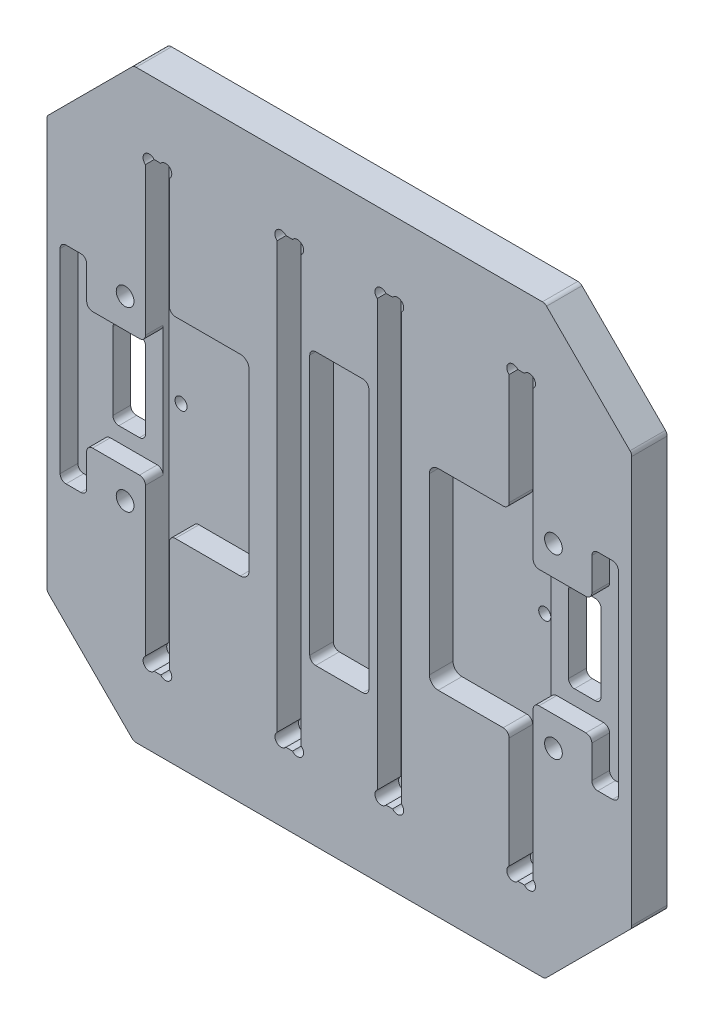
from build123d import *

# Parameters (mm, degrees)
ESQUISSE2_W                   = 200
ESQUISSE2_H                   = 200
BOSS_EXTRU_1_DEPTH            = 12
ENL_V_MAT_EXTRU_1_DEPTH       = 284.097156468
ENL_V_MAT_EXTRU_1_DEPTH_BACK  = 284.097156468
ESQUISSE3_R                   = 3
CHANFREIN1_SIZE               = 30
ENL_V_MAT_EXTRU_2_DEPTH       = 10
ESQUISSE5_W                   = 20
ESQUISSE5_H                   = 40
ENL_V_MAT_EXTRU_3_DEPTH       = 6
ESQUISSE6_W                   = 8.12
ESQUISSE6_H                   = 150
ENL_V_MAT_EXTRU_4_DEPTH       = 8
ESQUISSE7_R                   = 2.1
ENL_V_MAT_EXTRU_5_DEPTH       = 8
ESQUISSE8_W                   = 20
ESQUISSE8_H                   = 92
ENL_V_MAT_EXTRU_6_DEPTH       = 8
ENL_V_START                   = -8
ENL_V_MAT_EXTRU_8_DEPTH       = 8
ENL_V_MAT_EXTRU_9_DEPTH       = 283.906344927
ENL_V_MAT_EXTRU_9_DEPTH_BACK  = 283.906344927
ESQUISSE11_W                  = 11
ESQUISSE11_H                  = 30
CONG_1_R                      = 2
CONG_2_R                      = 2
ENL_V_MAT_EXTRU_7_DEPTH       = 284.097156468
ENL_V_MAT_EXTRU_7_DEPTH_BACK  = 284.097156468
CONG_3_R                      = 2
BOSS_EXTRU_2_START            = -4
BOSS_EXTRU_2_DEPTH            = 4
BOSS_EXTRU_3_DEPTH            = 6
ENL_V_MAT_EXTRU_10_DEPTH      = 282.542181564
ENL_V_MAT_EXTRU_10_DEPTH_BACK = 282.542181564
ESQUISSE14_R                  = 2.05


with BuildPart() as part:
    # Esquisse2 → Boss.-Extru.1 (new body)
    with BuildSketch(Plane.XY):
        with Locations((100, 100)):
            Rectangle(ESQUISSE2_W, ESQUISSE2_H)
    extrude(amount=BOSS_EXTRU_1_DEPTH)

    # Esquisse3 → Enlèv. mat.-Extru.1 (cut, two sides: drawn at the far end of the back side and taken through both)
    with BuildSketch(Plane.XY.offset(12).offset(-ENL_V_MAT_EXTRU_1_DEPTH_BACK)):
        with Locations((172.5, 130)):
            Circle(ESQUISSE3_R)
        with Locations(Location((172.5, 70, 0), (0, 0, 180))):
            Circle(ESQUISSE3_R)
        with Locations((27.5, 70)):
            Circle(ESQUISSE3_R)
        with Locations(Location((27.5, 130, 0), (0, 0, 180))):
            Circle(ESQUISSE3_R)
        with BuildLine():
            Line((185.5, 67), (185.5, 133))
            ThreePointArc((185.5, 133), (186.085786438, 134.414213562), (187.5, 135))
            Line((187.5, 135), (192.5, 135))
            ThreePointArc((192.5, 135), (193.914213562, 134.414213562), (194.5, 133))
            Line((194.5, 133), (194.5, 67))
            ThreePointArc((194.5, 67), (193.914213562, 65.585786438), (192.5, 65))
            Line((192.5, 65), (187.5, 65))
            ThreePointArc((187.5, 65), (186.085786438, 65.585786438), (185.5, 67))
        make_face()
        with BuildLine():
            Line((12.5, 65), (7.5, 65))
            ThreePointArc((7.5, 65), (6.085786438, 65.585786438), (5.5, 67))
            Line((5.5, 67), (5.5, 133))
            ThreePointArc((5.5, 133), (6.085786438, 134.414213562), (7.5, 135))
            Line((7.5, 135), (12.5, 135))
            ThreePointArc((12.5, 135), (13.914213562, 134.414213562), (14.5, 133))
            Line((14.5, 133), (14.5, 67))
            ThreePointArc((14.5, 67), (13.914213562, 65.585786438), (12.5, 65))
        make_face()
        with BuildLine():
            Line((69.5, 70.5), (69.5, 129.5))
            ThreePointArc((69.5, 129.5), (68.621320344, 131.621320344), (66.5, 132.5))
            Line((66.5, 132.5), (45.5, 132.5))
            ThreePointArc((45.5, 132.5), (43.378679656, 131.621320344), (42.5, 129.5))
            Line((42.5, 129.5), (42.5, 70.5))
            ThreePointArc((42.5, 70.5), (43.378679656, 68.378679656), (45.5, 67.5))
            Line((45.5, 67.5), (66.5, 67.5))
            ThreePointArc((66.5, 67.5), (68.621320344, 68.378679656), (69.5, 70.5))
        make_face()
        with BuildLine():
            Line((133.5, 67.5), (154.5, 67.5))
            ThreePointArc((154.5, 67.5), (156.621320344, 68.378679656), (157.5, 70.5))
            Line((157.5, 70.5), (157.5, 129.5))
            ThreePointArc((157.5, 129.5), (156.621320344, 131.621320344), (154.5, 132.5))
            Line((154.5, 132.5), (133.5, 132.5))
            ThreePointArc((133.5, 132.5), (131.378679656, 131.621320344), (130.5, 129.5))
            Line((130.5, 129.5), (130.5, 70.5))
            ThreePointArc((130.5, 70.5), (131.378679656, 68.378679656), (133.5, 67.5))
        make_face()
    extrude(amount=ENL_V_MAT_EXTRU_1_DEPTH + ENL_V_MAT_EXTRU_1_DEPTH_BACK, mode=Mode.SUBTRACT)

    # Chanfrein1
    chanfrein1_edges = [part.edges().sort_by_distance(p)[0] for p in [
        (0, 200, 6),
        (200, 200, 6),
        (200, 0, 6),
        (0, 0, 6),
    ]]
    chamfer(chanfrein1_edges, length=CHANFREIN1_SIZE)

    # Esquisse4 → Enlèv. mat.-Extru.2 (cut)
    with BuildSketch(Plane.XY.offset(12)):
        Polygon((170, 200), (30, 200), (0, 170), (0, 30), (30, 0), (170, 0), (200, 30), (200, 170), align=None)
        Polygon((169.585786438, 199), (30.414213562, 199), (1, 169.585786438), (1, 30.414213562), (30.414213562, 1), (169.585786438, 1), (199, 30.414213562), (199, 169.585786438), align=None, mode=Mode.SUBTRACT)
    extrude(amount=-ENL_V_MAT_EXTRU_2_DEPTH, mode=Mode.SUBTRACT)

    # Esquisse5 → Enlèv. mat.-Extru.3 (cut)
    with BuildSketch(Plane.XY.offset(12)):
        with Locations((24.5, 100)):
            Rectangle(ESQUISSE5_W, ESQUISSE5_H)
        with Locations((175.5, 100)):
            Rectangle(ESQUISSE5_W, ESQUISSE5_H)
    extrude(amount=-ENL_V_MAT_EXTRU_3_DEPTH, mode=Mode.SUBTRACT)

    # Esquisse6 → Enlèv. mat.-Extru.4 (cut)
    with BuildSketch(Plane.XY.offset(12)):
        with Locations((161.56, 100)):
            Rectangle(ESQUISSE6_W, ESQUISSE6_H)
        with Locations((38.44, 100)):
            Rectangle(ESQUISSE6_W, ESQUISSE6_H)
        with Locations((116.94, 100)):
            Rectangle(ESQUISSE6_W, ESQUISSE6_H)
        with Locations((83.06, 100)):
            Rectangle(ESQUISSE6_W, ESQUISSE6_H)
    extrude(amount=-ENL_V_MAT_EXTRU_4_DEPTH, mode=Mode.SUBTRACT)

    # Esquisse7 → Enlèv. mat.-Extru.5 (cut)
    with BuildSketch(Plane.XY.offset(12)):
        with Locations((114.18, 173.7)):
            Circle(ESQUISSE7_R)
        with Locations((119.7, 173.7)):
            Circle(ESQUISSE7_R)
        with Locations((119.7, 26.3)):
            Circle(ESQUISSE7_R)
        with Locations((114.18, 26.3)):
            Circle(ESQUISSE7_R)
        with Locations((164.32, 26.3)):
            Circle(ESQUISSE7_R)
        with Locations((158.8, 26.3)):
            Circle(ESQUISSE7_R)
        with Locations((158.8, 173.7)):
            Circle(ESQUISSE7_R)
        with Locations((164.32, 173.7)):
            Circle(ESQUISSE7_R)
        with Locations((35.68, 173.7)):
            Circle(ESQUISSE7_R)
        with Locations((41.2, 173.7)):
            Circle(ESQUISSE7_R)
        with Locations((41.2, 26.3)):
            Circle(ESQUISSE7_R)
        with Locations((35.68, 26.3)):
            Circle(ESQUISSE7_R)
        with Locations((85.82, 26.3)):
            Circle(ESQUISSE7_R)
        with Locations((80.3, 26.3)):
            Circle(ESQUISSE7_R)
        with Locations((80.3, 173.7)):
            Circle(ESQUISSE7_R)
        with Locations((85.82, 173.7)):
            Circle(ESQUISSE7_R)
    extrude(amount=-ENL_V_MAT_EXTRU_5_DEPTH, mode=Mode.SUBTRACT)

    # Esquisse8 → Enlèv. mat.-Extru.6 (cut)
    with BuildSketch(Plane.XY.offset(12)):
        with Locations((100, 100)):
            Rectangle(ESQUISSE8_W, ESQUISSE8_H)
    extrude(amount=-ENL_V_MAT_EXTRU_6_DEPTH, mode=Mode.SUBTRACT)

    # Esquisse10 → Enlèv. mat.-Extru.8 (cut)
    with BuildSketch(Plane.XY.offset(12).offset(ENL_V_START)):
        Polygon((45.5, 132.5), (42.5, 132.5), (42.5, 129.5), align=None)
        Polygon((42.5, 70.5), (45.5, 67.5), (42.5, 67.5), align=None)
        Polygon((154.5, 67.5), (157.5, 67.5), (157.5, 70.5), align=None)
        Polygon((157.5, 129.5), (154.5, 132.5), (157.5, 132.5), align=None)
    extrude(amount=ENL_V_MAT_EXTRU_8_DEPTH, mode=Mode.SUBTRACT)

    # Esquisse11 → Enlèv. mat.-Extru.9 (cut, two sides: drawn at the far end of the back side and taken through both)
    with BuildSketch(Plane.XY.offset(6).offset(-ENL_V_MAT_EXTRU_9_DEPTH_BACK)):
        with Locations((22.88, 100)):
            Rectangle(ESQUISSE11_W, ESQUISSE11_H)
        with Locations((177.12, 100)):
            Rectangle(ESQUISSE11_W, ESQUISSE11_H)
    extrude(amount=ENL_V_MAT_EXTRU_9_DEPTH + ENL_V_MAT_EXTRU_9_DEPTH_BACK, mode=Mode.SUBTRACT)

    # Congé1
    cong_1_edges = [part.edges().sort_by_distance(p)[0] for p in [
        (185.5, 120, 9),
        (185.5, 80, 9),
        (14.5, 120, 9),
        (14.5, 80, 9),
        (165.62, 120, 9),
        (165.62, 80, 9),
        (34.38, 120, 9),
        (34.38, 80, 9),
        (90, 146, 8),
        (110, 146, 8),
        (110, 54, 8),
        (90, 54, 8),
        (42.5, 132.5, 8),
        (42.5, 67.5, 8),
        (157.5, 67.5, 8),
        (157.5, 132.5, 8),
    ]]
    fillet(cong_1_edges, radius=CONG_1_R)

    # Congé2
    cong_2_edges = [part.edges().sort_by_distance(p)[0] for p in [
        (0, 30, 1),
        (30, 200, 1),
        (200, 170, 1),
        (170, 0, 1),
        (30, 0, 1),
        (200, 30, 1),
        (170, 200, 1),
        (0, 170, 1),
        (199, 169.585786438, 7),
        (199, 30.414213562, 7),
        (169.585786438, 1, 7),
        (30.414213562, 1, 7),
        (1, 30.414213562, 7),
        (1, 169.585786438, 7),
        (30.414213562, 199, 7),
        (169.585786438, 199, 7),
    ]]
    fillet(cong_2_edges, radius=CONG_2_R)

    # Esquisse9 → Enlèv. mat.-Extru.7 (cut, two sides: drawn at the far end of the back side and taken through both)
    with BuildSketch(Plane.XY.offset(12).offset(-ENL_V_MAT_EXTRU_7_DEPTH_BACK)):
        with BuildLine():
            Line((22.757359313, 205.485281374), (-5.485281374, 177.242640687))
            ThreePointArc((-5.485281374, 177.242640687), (-8.08655439, 173.349560501), (-9, 168.757359313))
            Line((-9, 168.757359313), (-9, 31.242640687))
            ThreePointArc((-9, 31.242640687), (-8.08655439, 26.650439499), (-5.485281374, 22.757359313))
            Line((-5.485281374, 22.757359313), (22.757359313, -5.485281374))
            ThreePointArc((22.757359313, -5.485281374), (26.650439499, -8.08655439), (31.242640687, -9))
            Line((31.242640687, -9), (168.757359313, -9))
            ThreePointArc((168.757359313, -9), (173.349560501, -8.08655439), (177.242640687, -5.485281374))
            Line((177.242640687, -5.485281374), (205.485281374, 22.757359313))
            ThreePointArc((205.485281374, 22.757359313), (208.08655439, 26.650439499), (209, 31.242640687))
            Line((209, 31.242640687), (209, 168.757359313))
            ThreePointArc((209, 168.757359313), (208.08655439, 173.349560501), (205.485281374, 177.242640687))
            Line((205.485281374, 177.242640687), (177.242640687, 205.485281374))
            ThreePointArc((177.242640687, 205.485281374), (173.349560501, 208.08655439), (168.757359313, 209))
            Line((168.757359313, 209), (31.242640687, 209))
            ThreePointArc((31.242640687, 209), (26.650439499, 208.08655439), (22.757359313, 205.485281374))
        make_face()
        with BuildLine():
            Line((29.828427125, 198.414213562), (1.585786438, 170.171572875))
            ThreePointArc((1.585786438, 170.171572875), (1.152240935, 169.522726178), (1, 168.757359313))
            Line((1, 168.757359313), (1, 31.242640687))
            ThreePointArc((1, 31.242640687), (1.152240935, 30.477273822), (1.585786438, 29.828427125))
            Line((1.585786438, 29.828427125), (29.828427125, 1.585786438))
            ThreePointArc((29.828427125, 1.585786438), (30.477273822, 1.152240935), (31.242640687, 1))
            Line((31.242640687, 1), (168.757359313, 1))
            ThreePointArc((168.757359313, 1), (169.522726178, 1.152240935), (170.171572875, 1.585786438))
            Line((170.171572875, 1.585786438), (198.414213562, 29.828427125))
            ThreePointArc((198.414213562, 29.828427125), (198.847759065, 30.477273822), (199, 31.242640687))
            Line((199, 31.242640687), (199, 168.757359313))
            ThreePointArc((199, 168.757359313), (198.847759065, 169.522726178), (198.414213562, 170.171572875))
            Line((198.414213562, 170.171572875), (170.171572875, 198.414213562))
            ThreePointArc((170.171572875, 198.414213562), (169.522726178, 198.847759065), (168.757359313, 199))
            Line((168.757359313, 199), (31.242640687, 199))
            ThreePointArc((31.242640687, 199), (30.477273822, 198.847759065), (29.828427125, 198.414213562))
        make_face(mode=Mode.SUBTRACT)
    extrude(amount=ENL_V_MAT_EXTRU_7_DEPTH + ENL_V_MAT_EXTRU_7_DEPTH_BACK, mode=Mode.SUBTRACT)

    # Congé3
    cong_3_edges = [part.edges().sort_by_distance(p)[0] for p in [
        (17.38, 85, 3),
        (17.38, 115, 3),
        (28.38, 115, 3),
        (28.38, 85, 3),
        (171.62, 115, 3),
        (182.62, 115, 3),
        (182.62, 85, 3),
        (171.62, 85, 3),
    ]]
    fillet(cong_3_edges, radius=CONG_3_R)

    # Esquisse12 → Boss.-Extru.2 (add)
    with BuildSketch(Plane(origin=(0, 0, 0), x_dir=(-1, 0, 0), z_dir=(0, 0, -1)).offset(BOSS_EXTRU_2_START)):
        with BuildLine():
            Line((-69.5, 70.5), (-69.5, 129.5))
            ThreePointArc((-69.5, 129.5), (-68.621320344, 131.621320344), (-66.5, 132.5))
            Line((-66.5, 132.5), (-45.5, 132.5))
            ThreePointArc((-45.5, 132.5), (-43.378679656, 131.621320344), (-42.5, 129.5))
            Line((-42.5, 129.5), (-42.5, 70.5))
            ThreePointArc((-42.5, 70.5), (-43.378679656, 68.378679656), (-45.5, 67.5))
            Line((-45.5, 67.5), (-66.5, 67.5))
            ThreePointArc((-66.5, 67.5), (-68.621320344, 68.378679656), (-69.5, 70.5))
        make_face()
        with BuildLine():
            Line((-133.5, 67.5), (-154.5, 67.5))
            ThreePointArc((-154.5, 67.5), (-156.621320344, 68.378679656), (-157.5, 70.5))
            Line((-157.5, 70.5), (-157.5, 129.5))
            ThreePointArc((-157.5, 129.5), (-156.621320344, 131.621320344), (-154.5, 132.5))
            Line((-154.5, 132.5), (-133.5, 132.5))
            ThreePointArc((-133.5, 132.5), (-131.378679656, 131.621320344), (-130.5, 129.5))
            Line((-130.5, 129.5), (-130.5, 70.5))
            ThreePointArc((-130.5, 70.5), (-131.378679656, 68.378679656), (-133.5, 67.5))
        make_face()
    extrude(amount=BOSS_EXTRU_2_DEPTH)

    # Esquisse13 → Boss.-Extru.3 (add)
    with BuildSketch(Plane(origin=(0, 0, 0), x_dir=(-1, 0, 0), z_dir=(0, 0, -1))):
        with BuildLine():
            Line((-14.5, 67), (-14.5, 133))
            ThreePointArc((-14.5, 133), (-13.914213562, 134.414213562), (-12.5, 135))
            Line((-12.5, 135), (-7.5, 135))
            ThreePointArc((-7.5, 135), (-6.085786438, 134.414213562), (-5.5, 133))
            Line((-5.5, 133), (-5.5, 67))
            ThreePointArc((-5.5, 67), (-6.085786438, 65.585786438), (-7.5, 65))
            Line((-7.5, 65), (-12.5, 65))
            ThreePointArc((-12.5, 65), (-13.914213562, 65.585786438), (-14.5, 67))
        make_face()
        with BuildLine():
            Line((-187.5, 65), (-192.5, 65))
            ThreePointArc((-192.5, 65), (-193.914213562, 65.585786438), (-194.5, 67))
            Line((-194.5, 67), (-194.5, 133))
            ThreePointArc((-194.5, 133), (-193.914213562, 134.414213562), (-192.5, 135))
            Line((-192.5, 135), (-187.5, 135))
            ThreePointArc((-187.5, 135), (-186.085786438, 134.414213562), (-185.5, 133))
            Line((-185.5, 133), (-185.5, 67))
            ThreePointArc((-185.5, 67), (-186.085786438, 65.585786438), (-187.5, 65))
        make_face()
    extrude(amount=-BOSS_EXTRU_3_DEPTH)

    # Esquisse14 → Enlèv. mat.-Extru.10 (cut, two sides: drawn at the far end of the back side and taken through both)
    with BuildSketch(Plane.XY.offset(4).offset(-ENL_V_MAT_EXTRU_10_DEPTH_BACK)):
        with Locations((83.06, 160)):
            Circle(ESQUISSE14_R)
        with Locations((83.06, 40)):
            Circle(ESQUISSE14_R)
        with Locations((83.06, 100)):
            Circle(ESQUISSE14_R)
        with Locations((38.44, 100)):
            Circle(ESQUISSE14_R)
        with Locations((38.44, 40)):
            Circle(ESQUISSE14_R)
        with Locations((38.44, 160)):
            Circle(ESQUISSE14_R)
        with Locations((161.56, 160)):
            Circle(ESQUISSE14_R)
        with Locations((161.56, 40)):
            Circle(ESQUISSE14_R)
        with Locations((161.56, 100)):
            Circle(ESQUISSE14_R)
        with Locations((116.94, 100)):
            Circle(ESQUISSE14_R)
        with Locations((116.94, 40)):
            Circle(ESQUISSE14_R)
        with Locations((116.94, 160)):
            Circle(ESQUISSE14_R)
    extrude(amount=ENL_V_MAT_EXTRU_10_DEPTH + ENL_V_MAT_EXTRU_10_DEPTH_BACK, mode=Mode.SUBTRACT)


solid = part.part
